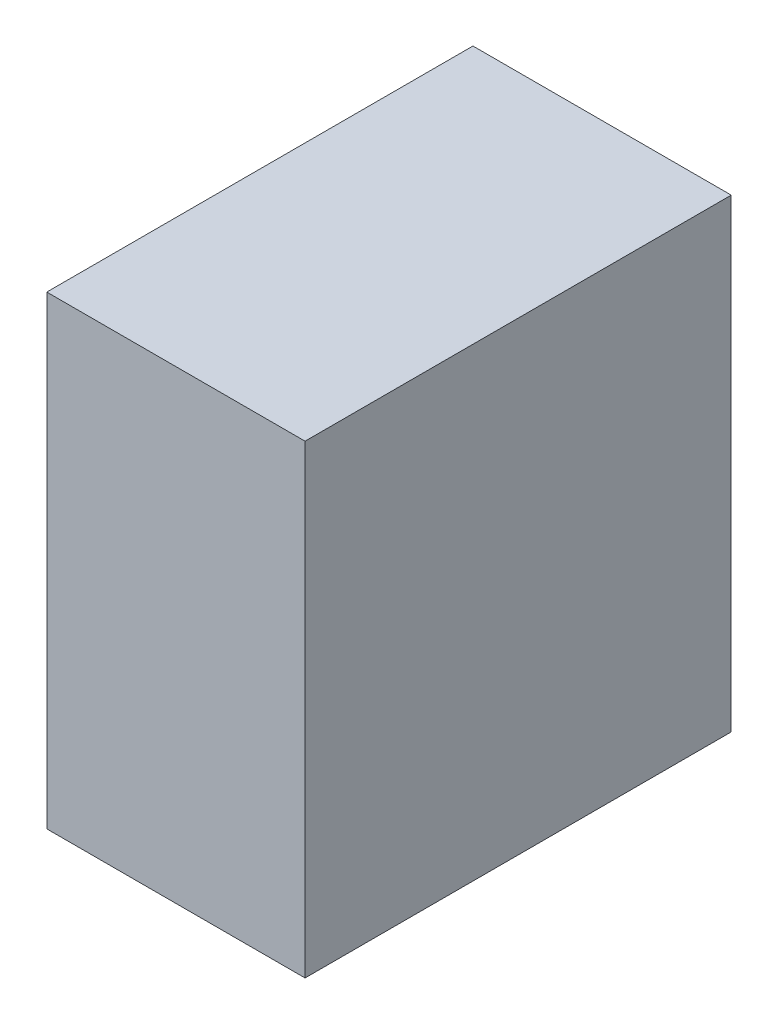
from build123d import *

# Parameters (mm, degrees)
SKETCH1_W           = 20
SKETCH1_H           = 33
SKETCH1_W_2         = 17
SKETCH1_H_2         = 30
BOSS_EXTRUDE1_DEPTH = 35
SKETCH2_W           = 20
SKETCH2_H           = 33
BOSS_EXTRUDE2_DEPTH = 1
SKETCH3_W           = 1.5
SKETCH3_H           = 2
BOSS_EXTRUDE3_DEPTH = 35


with BuildPart() as part:
    # Sketch1 → Boss-Extrude1 (new body)
    with BuildSketch(Plane(origin=(0, 0, 0), x_dir=(1, 0, 0), z_dir=(0, 1, 0))):
        Rectangle(SKETCH1_W, SKETCH1_H)
        Rectangle(SKETCH1_W_2, SKETCH1_H_2, mode=Mode.SUBTRACT)
    extrude(amount=BOSS_EXTRUDE1_DEPTH)

    # Sketch2 → Boss-Extrude2 (add)
    with BuildSketch(Plane(origin=(0, 35, 0), x_dir=(1, 0, 0), z_dir=(0, 1, 0))):
        Rectangle(SKETCH2_W, SKETCH2_H)
    extrude(amount=BOSS_EXTRUDE2_DEPTH)

    # Sketch3 → Boss-Extrude3 (add)
    with BuildSketch(Plane.XZ):
        with Locations((-2.75, -14)):
            Rectangle(SKETCH3_W, SKETCH3_H)
        with Locations((2.75, -14)):
            Rectangle(SKETCH3_W, SKETCH3_H)
        with Locations((2.75, 14)):
            Rectangle(SKETCH3_W, SKETCH3_H)
        with Locations((-2.75, 14)):
            Rectangle(SKETCH3_W, SKETCH3_H)
    extrude(amount=-BOSS_EXTRUDE3_DEPTH)


solid = part.part
